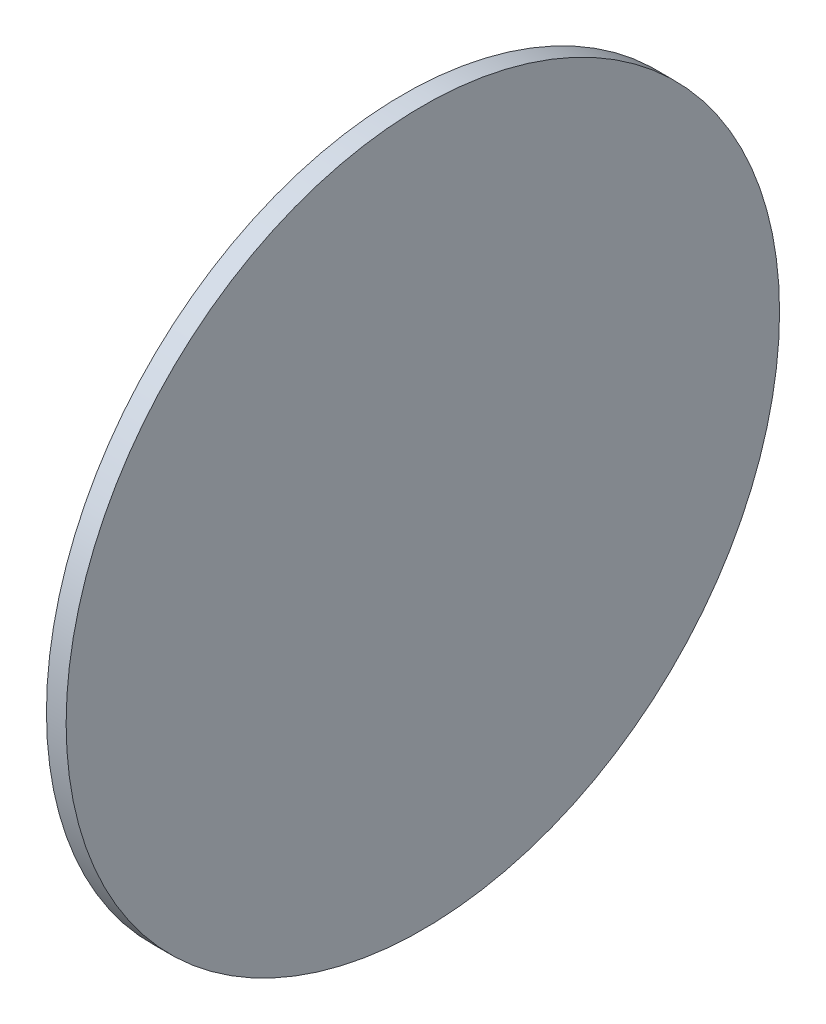
from build123d import *

# Parameters (mm, degrees)
SKETCH1_R           = 72.5
BOSS_EXTRUDE1_DEPTH = 4


with BuildPart() as part:
    # Sketch1 → Boss-Extrude1 (new body)
    with BuildSketch(Plane(origin=(0, 0, 0), x_dir=(0, 0, -1), z_dir=(1, 0, 0))):
        Circle(SKETCH1_R)
    extrude(amount=BOSS_EXTRUDE1_DEPTH)


solid = part.part
